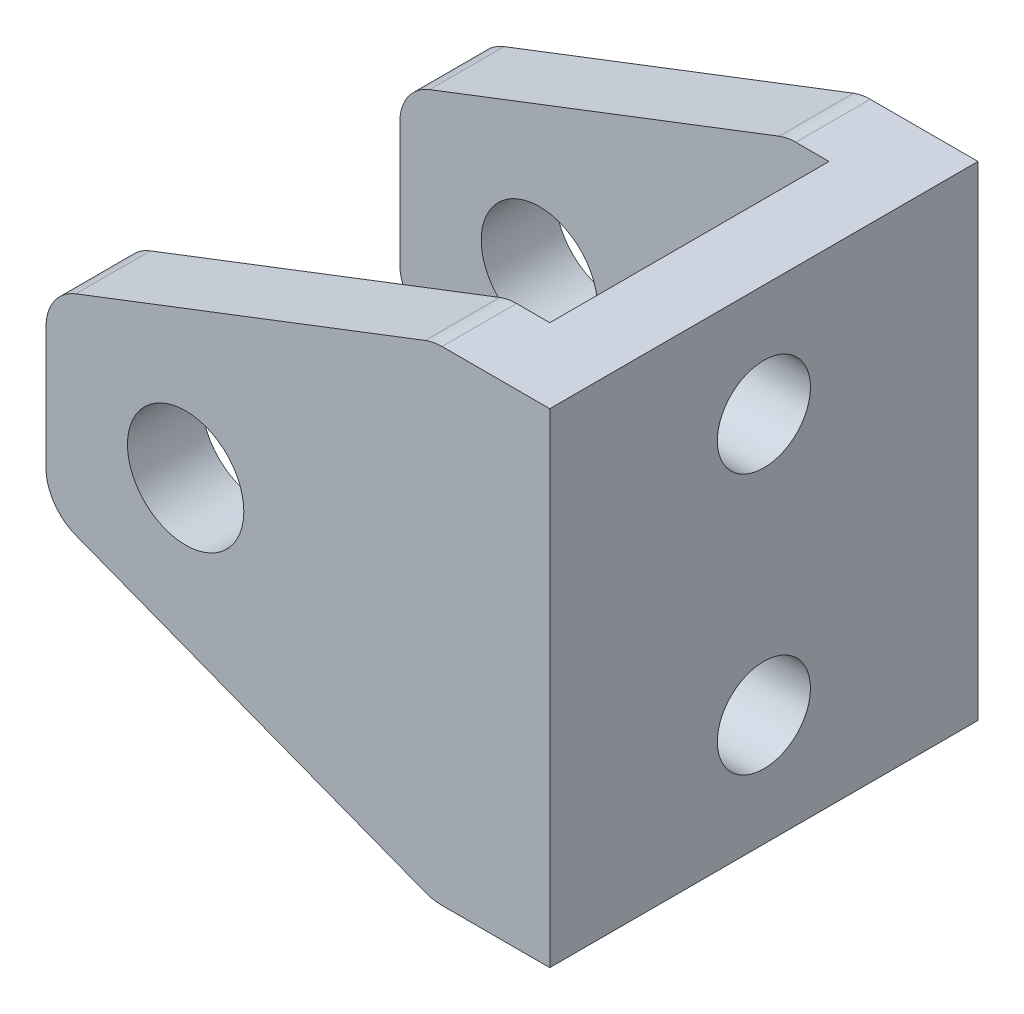
from build123d import *

# Parameters (mm, degrees)
BOSS_EXTRUDE1_DEPTH = 33.02
CUT_EXTRUDE1_REACH  = 794.952
SKETCH2_R           = 3.175
SKETCH3_R           = 3.96875
CUT_EXTRUDE2_DEPTH  = 794.354962335
FILLET1_R           = 3.175


with BuildPart() as part:
    # Sketch1 → Boss-Extrude1 (new body)
    with BuildSketch(Plane(origin=(0, -759.052062329, 0), x_dir=(-1, 0, 0), z_dir=(0, -1, 0))):
        Polygon((0, 14.605), (0, -14.605), (34.361609966, -14.605), (34.361609966, -9.525), (5.08, -9.525), (5.08, 9.525), (34.361609966, 9.525), (34.361609966, 14.605), align=None)
    extrude(amount=BOSS_EXTRUDE1_DEPTH)

    # Sketch2 → Cut-Extrude1 (cut, up to next)
    with BuildSketch(Plane(origin=(0, 0, 0), x_dir=(0, 0, -1), z_dir=(1, 0, 0)), mode=Mode.PRIVATE) as cut_extrude1_sk1:
        with Locations(Location((0, -784.452062329, 0), (0, 0, 90))):
            Circle(SKETCH2_R)
    cut_extrude1_tool1 = extrude(cut_extrude1_sk1.sketch, amount=-CUT_EXTRUDE1_REACH, mode=Mode.PRIVATE) & part.part
    # Sketch2 → Cut-Extrude1 (cut, up to next)
    with BuildSketch(Plane(origin=(0, 0, 0), x_dir=(0, 0, -1), z_dir=(1, 0, 0)), mode=Mode.PRIVATE) as cut_extrude1_sk2:
        with Locations(Location((0, -766.672062329, 0), (0, 0, 90))):
            Circle(SKETCH2_R)
    cut_extrude1_tool2 = extrude(cut_extrude1_sk2.sketch, amount=-CUT_EXTRUDE1_REACH, mode=Mode.PRIVATE) & part.part
    add(cut_extrude1_tool1.solids().sort_by_distance((0, -784.452062, 0))[0], mode=Mode.SUBTRACT)
    add(cut_extrude1_tool2.solids().sort_by_distance((0, -766.672062, 0))[0], mode=Mode.SUBTRACT)

    # Sketch3 → Cut-Extrude2 (cut, through all)
    with BuildSketch(Plane.XY.offset(14.605)):
        with Locations((-24.836609966, -775.562062329)):
            Circle(SKETCH3_R)
        Polygon((-7.9375, -759.052062329), (-34.361609966, -769.212062329), (-34.361609966, -759.052062329), align=None)
        Polygon((-34.361609966, -792.072062329), (-34.361609966, -781.912062329), (-7.9375, -792.072062329), align=None)
    extrude(amount=-CUT_EXTRUDE2_DEPTH, mode=Mode.SUBTRACT)

    # Fillet1
    fillet1_edges = [part.edges().sort_by_distance(p)[0] for p in [
        (-7.9375, -759.052062329, 12.065),
        (-7.9375, -792.072062329, 12.065),
        (-34.361609966, -781.912062329, 12.065),
        (-7.9375, -792.072062329, -12.065),
        (-34.361609966, -781.912062329, -12.065),
        (-34.361609966, -769.212062329, 12.065),
        (-7.9375, -759.052062329, -12.065),
        (-34.361609966, -769.212062329, -12.065),
    ]]
    fillet(fillet1_edges, radius=FILLET1_R)


solid = part.part
